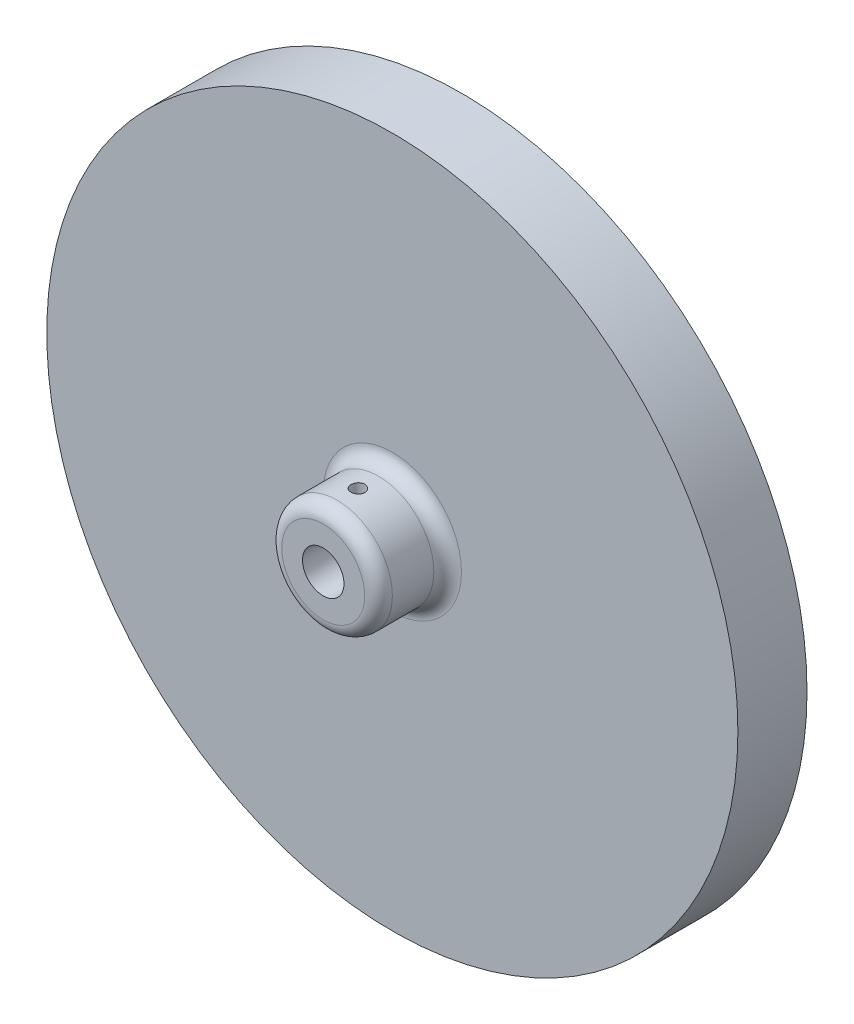
from build123d import *

# Parameters (mm, degrees)
SKETCH1_R               = 50
BOSS_EXTRUDE1_DEPTH     = 5
SKETCH2_R               = 8
BOSS_EXTRUDE2_DEPTH     = 10
SKETCH3_R               = 3
CUT_EXTRUDE1_DEPTH      = 74.484692283
FILLET1_R               = 2
CUT_EXTRUDE2_DEPTH      = 73.284161474
CUT_EXTRUDE2_DEPTH_BACK = 73.284161474
SKETCH4_R               = 1


with BuildPart() as part:
    # Sketch1 → Boss-Extrude1 (new, symmetric)
    with BuildSketch(Plane.XY):
        Circle(SKETCH1_R)
    extrude(amount=BOSS_EXTRUDE1_DEPTH, both=True)

    # Sketch2 → Boss-Extrude2 (add)
    with BuildSketch(Plane.XY.offset(5)):
        Circle(SKETCH2_R)
    extrude(amount=BOSS_EXTRUDE2_DEPTH)

    # Sketch3 → Cut-Extrude1 (cut, through all)
    with BuildSketch(Plane.XY.offset(15)):
        Circle(SKETCH3_R)
    extrude(amount=-CUT_EXTRUDE1_DEPTH, mode=Mode.SUBTRACT)

    # Fillet1
    fillet1_edges = [part.edges().sort_by_distance(p)[0] for p in [
        (-8, 0, 5),
        (-8, 0, 15),
    ]]
    fillet(fillet1_edges, radius=FILLET1_R)

    # Sketch4 → Cut-Extrude2 (cut, two sides: drawn at the far end of the back side and taken through both)
    with BuildSketch(Plane(origin=(0, 0, 0), x_dir=(1, 0, 0), z_dir=(0, 1, 0)).offset(-CUT_EXTRUDE2_DEPTH_BACK)):
        with Locations(Location((0, -10, 0), (0, 0, 270))):
            Circle(SKETCH4_R)
    extrude(amount=CUT_EXTRUDE2_DEPTH + CUT_EXTRUDE2_DEPTH_BACK, mode=Mode.SUBTRACT)


solid = part.part
